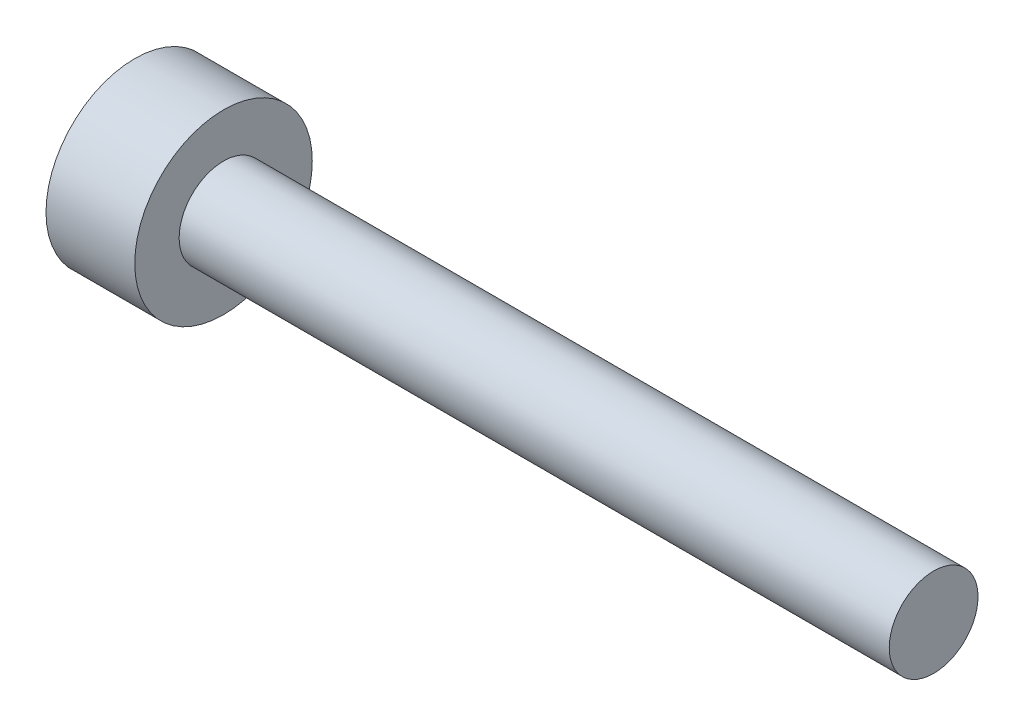
from build123d import *

# Parameters (mm, degrees)
SKETCH1_R           = 2.5
BOSS_EXTRUDE1_DEPTH = 40
SKETCH2_R           = 5
BOSS_EXTRUDE2_DEPTH = 5


with BuildPart() as part:
    # Sketch1 → Boss-Extrude1 (new body)
    with BuildSketch(Plane(origin=(0, 0, 0), x_dir=(0, 0, -1), z_dir=(1, 0, 0))):
        Circle(SKETCH1_R)
    extrude(amount=BOSS_EXTRUDE1_DEPTH)

    # Sketch2 → Boss-Extrude2 (add)
    with BuildSketch(Plane.ZY):
        Circle(SKETCH2_R)
    extrude(amount=BOSS_EXTRUDE2_DEPTH)


solid = part.part
